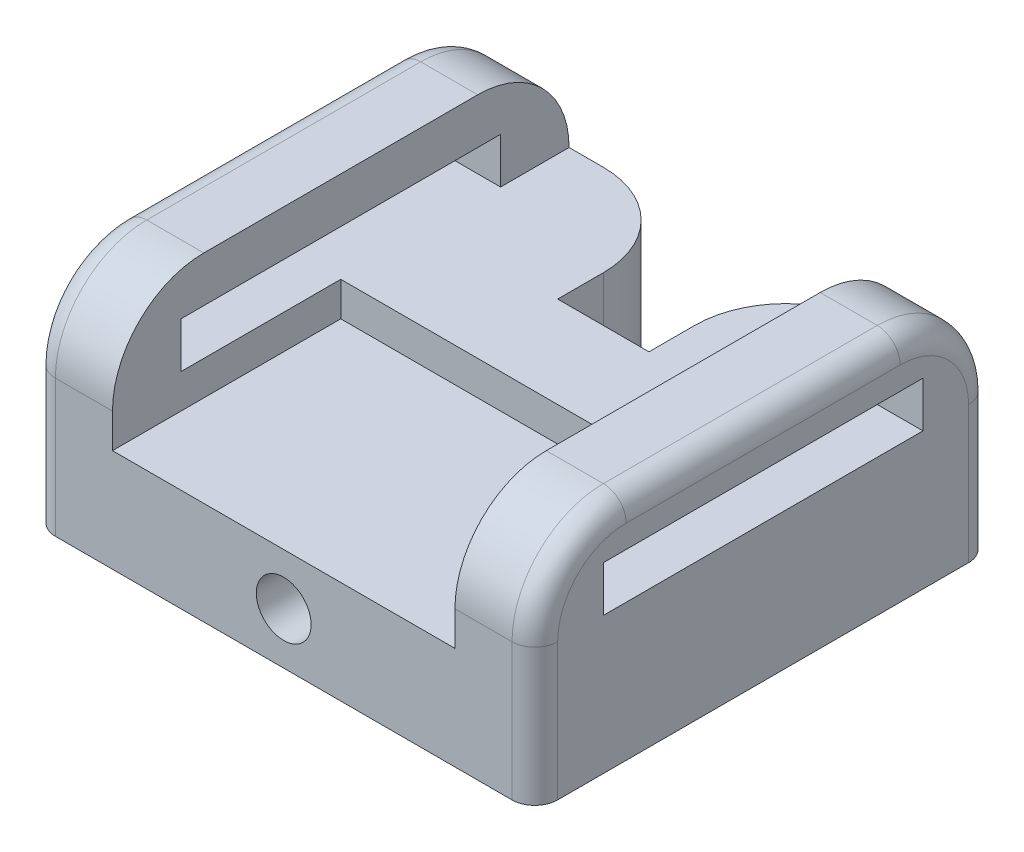
from build123d import *

# Parameters (mm, degrees)
SKETCH1_W           = 11
SKETCH1_H           = 10
BOSS_EXTRUDE1_DEPTH = 3
CUT_EXTRUDE4_DEPTH  = 12
CUT_EXTRUDE5_DEPTH  = 0.75
SKETCH6_W           = 1.75
SKETCH6_H           = 1.5
BOSS_EXTRUDE2_DEPTH = 1
SKETCH7_W           = 1.75
SKETCH7_H           = 10
BOSS_EXTRUDE3_DEPTH = 1
CUT_EXTRUDE6_DEPTH  = 12
FILLET4_R           = 2
FILLET5_R           = 2
FILLET6_R           = 0.5
FILLET7_R           = 0.5


with BuildPart() as part:
    # Sketch1 → Boss-Extrude1 (new body)
    with BuildSketch(Plane(origin=(0, 0, 0), x_dir=(1, 0, 0), z_dir=(0, 1, 0))):
        with Locations((-109.833038928, -31.060593966)):
            Rectangle(SKETCH1_W, SKETCH1_H)
    extrude(amount=BOSS_EXTRUDE1_DEPTH)

    # Sketch2 → Cut-Extrude4 (cut)
    with BuildSketch(Plane(origin=(0, 3, 0), x_dir=(1, 0, 0), z_dir=(0, 1, 0))):
        Polygon((-108.833038928, -26.060593966), (-110.833038928, -26.060593966), (-110.833038928, -29.060593966), (-109.833038928, -29.060593966), (-108.833038928, -29.060593966), align=None)
    extrude(amount=-CUT_EXTRUDE4_DEPTH, mode=Mode.SUBTRACT)

    # Sketch5 → Cut-Extrude5 (cut)
    with BuildSketch(Plane(origin=(0, 3, 0), x_dir=(1, 0, 0), z_dir=(0, 1, 0))):
        Polygon((-109.833038928, -36.060593966), (-113.583038928, -36.060593966), (-113.583038928, -31.060593966), (-106.083038928, -31.060593966), (-106.083038928, -36.060593966), align=None)
    extrude(amount=-CUT_EXTRUDE5_DEPTH, mode=Mode.SUBTRACT)

    # Sketch6 → Boss-Extrude2 (add)
    with BuildSketch(Plane(origin=(0, 3, 0), x_dir=(1, 0, 0), z_dir=(0, 1, 0))):
        with Locations((-114.458038928, -35.310593966)):
            Rectangle(SKETCH6_W, SKETCH6_H)
        with Locations((-114.458038928, -26.810593966)):
            Rectangle(SKETCH6_W, SKETCH6_H)
        with Locations((-105.208038928, -26.810593966)):
            Rectangle(SKETCH6_W, SKETCH6_H)
        with Locations((-105.208038928, -35.310593966)):
            Rectangle(SKETCH6_W, SKETCH6_H)
    extrude(amount=BOSS_EXTRUDE2_DEPTH)

    # Sketch7 → Boss-Extrude3 (add)
    with BuildSketch(Plane(origin=(0, 4, 0), x_dir=(1, 0, 0), z_dir=(0, 1, 0))):
        with Locations((-114.458038928, -31.060593966)):
            Rectangle(SKETCH7_W, SKETCH7_H)
        with Locations((-105.208038928, -31.060593966)):
            Rectangle(SKETCH7_W, SKETCH7_H)
    extrude(amount=BOSS_EXTRUDE3_DEPTH)

    # Sketch8 → Cut-Extrude6 (cut)
    with BuildSketch(Plane.XY.offset(36.060593966)):
        with BuildLine():
            ThreePointArc((-109.233038928, 1.125), (-109.40877486, 1.549264069), (-109.833038928, 1.725))
            Line((-109.833038928, 1.725), (-109.833038928, 0.525))
            ThreePointArc((-109.833038928, 0.525), (-109.40877486, 0.700735931), (-109.233038928, 1.125))
        make_face()
        with BuildLine():
            Line((-109.833038928, 0.525), (-109.833038928, 1.725))
            ThreePointArc((-109.833038928, 1.725), (-110.433038928, 1.125), (-109.833038928, 0.525))
        make_face()
    extrude(amount=-CUT_EXTRUDE6_DEPTH, mode=Mode.SUBTRACT)

    # Fillet4
    fillet4_edges = [part.edges().sort_by_distance(p)[0] for p in [
        (-110.833038928, 1.5, 26.060593966),
        (-108.833038928, 1.5, 26.060593966),
    ]]
    fillet(fillet4_edges, radius=FILLET4_R)

    # Fillet5
    fillet5_edges = [part.edges().sort_by_distance(p)[0] for p in [
        (-105.208038928, 5, 26.060593966),
        (-114.458038928, 5, 26.060593966),
        (-105.208038928, 5, 36.060593966),
        (-114.458038928, 5, 36.060593966),
    ]]
    fillet(fillet5_edges, radius=FILLET5_R)

    # Fillet6
    fillet6_edges = [part.edges().sort_by_distance(p)[0] for p in [
        (-104.333038928, 5, 31.060593966),
        (-104.333038928, 1.5, 26.060593966),
        (-104.333038928, 1.5, 36.060593966),
        (-104.333038928, 4.414213562, 35.474807528),
        (-104.333038928, 4.414213562, 26.646380403),
    ]]
    fillet(fillet6_edges, radius=FILLET6_R)

    # Fillet7
    fillet7_edges = [part.edges().sort_by_distance(p)[0] for p in [
        (-115.333038928, 5, 31.060593966),
        (-115.333038928, 1.5, 36.060593966),
        (-115.333038928, 1.5, 26.060593966),
        (-115.333038928, 4.414213562, 35.474807528),
        (-115.333038928, 4.414213562, 26.646380403),
    ]]
    fillet(fillet7_edges, radius=FILLET7_R)


solid = part.part
